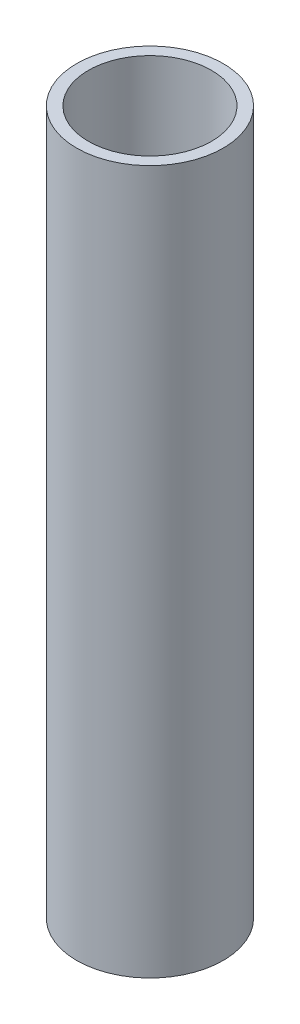
from build123d import *

# Parameters (mm, degrees)
SKETCH1_R           = 12.5
SKETCH1_R_2         = 10.5
EXTRUDE_THIN1_DEPTH = 120


with BuildPart() as part:
    # Sketch1 → Extrude-Thin1 (new body)
    with BuildSketch(Plane(origin=(0, 0, 0), x_dir=(1, 0, 0), z_dir=(0, 1, 0))):
        Circle(SKETCH1_R)
        Circle(SKETCH1_R_2, mode=Mode.SUBTRACT)
    extrude(amount=EXTRUDE_THIN1_DEPTH)


solid = part.part
